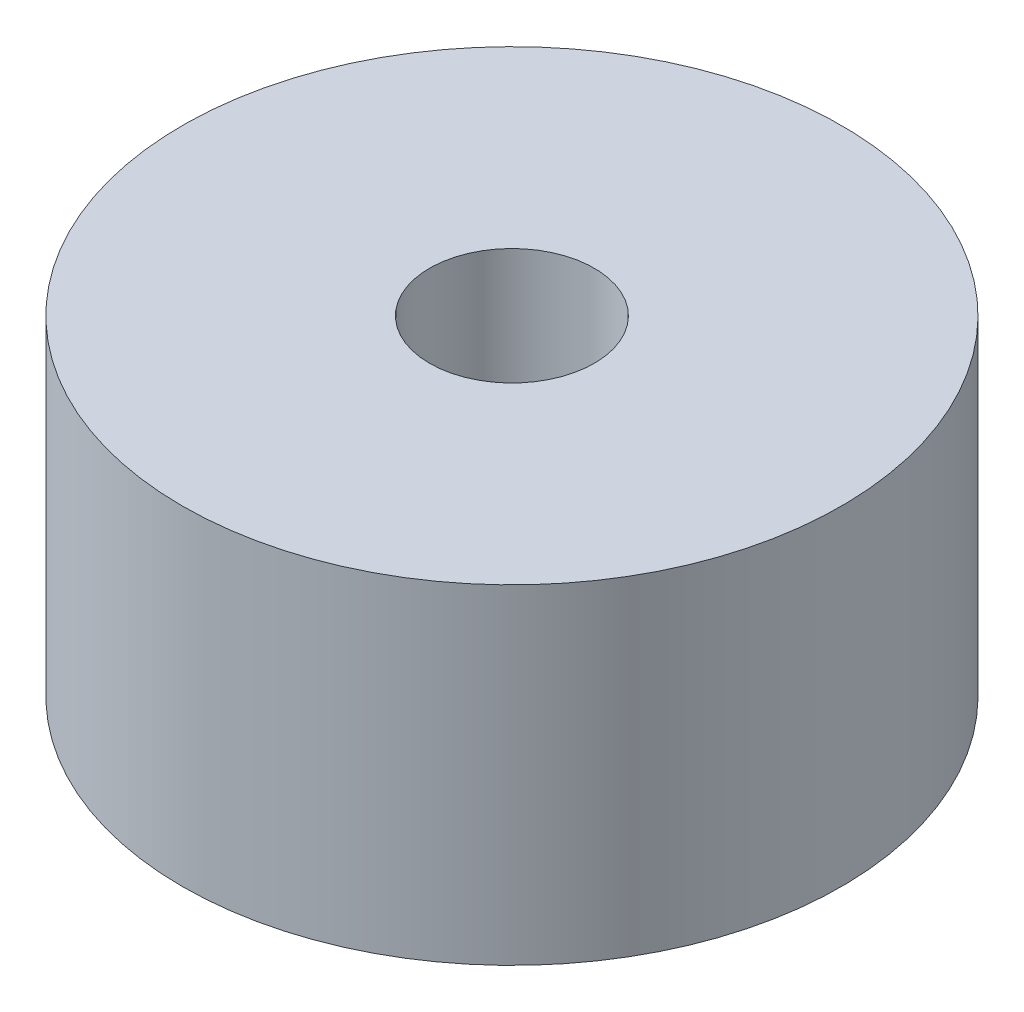
from build123d import *

# Parameters (mm, degrees)
SKETCH1_R           = 12.7
SKETCH1_R_2         = 3.175
BOSS_EXTRUDE1_DEPTH = 12.7


with BuildPart() as part:
    # Sketch1 → Boss-Extrude1 (new body)
    with BuildSketch(Plane(origin=(0, 0, 0), x_dir=(1, 0, 0), z_dir=(0, 1, 0))):
        with Locations(Location((0, 0, 0), (0, 0, 270))):
            Circle(SKETCH1_R)
        with Locations(Location((0, 0, 0), (0, 0, 270))):
            Circle(SKETCH1_R_2, mode=Mode.SUBTRACT)
    extrude(amount=BOSS_EXTRUDE1_DEPTH)


solid = part.part
